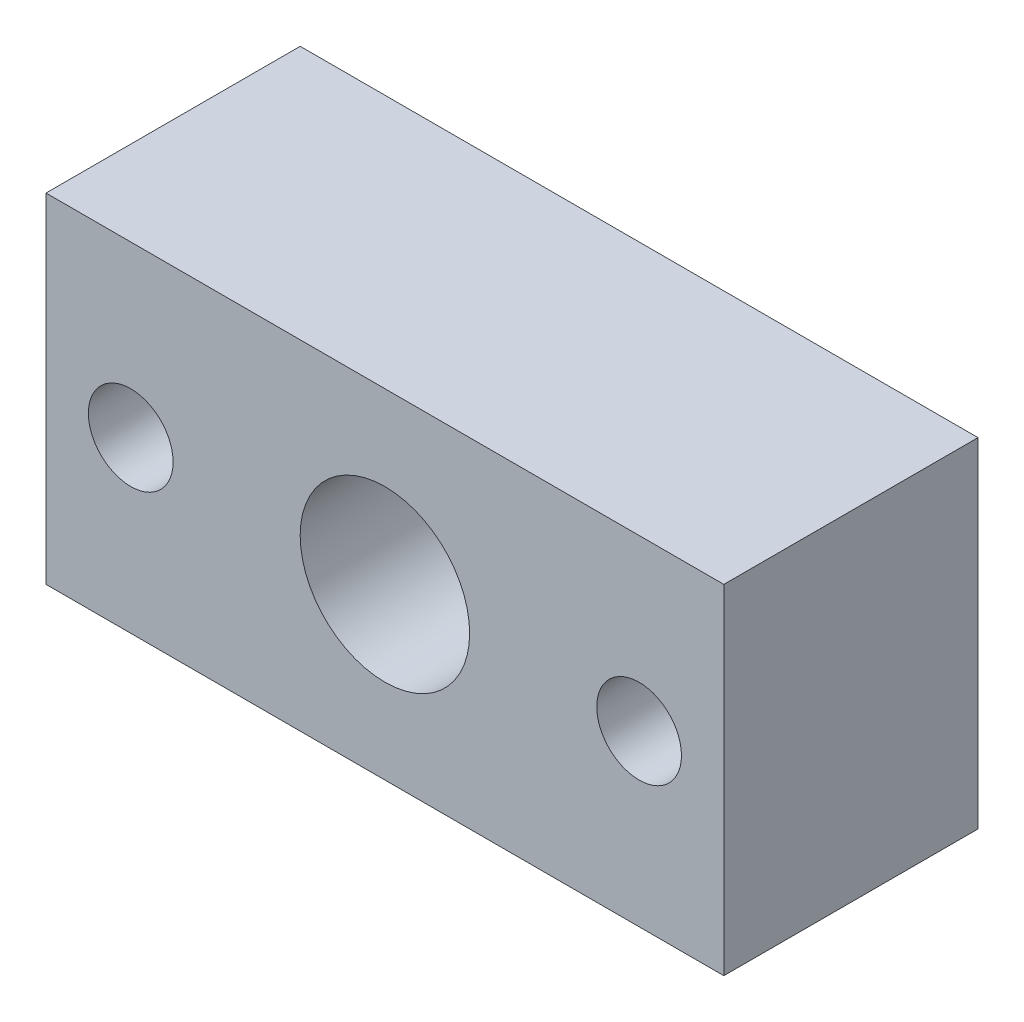
from build123d import *

# Parameters (mm, degrees)
SKETCH1_W           = 40
SKETCH1_H           = 20
SKETCH1_R           = 5
SKETCH1_R_2         = 2.5
BOSS_EXTRUDE1_DEPTH = 15


with BuildPart() as part:
    # Sketch1 → Boss-Extrude1 (new body)
    with BuildSketch(Plane.XY):
        with Locations((20, 10)):
            Rectangle(SKETCH1_W, SKETCH1_H)
        with Locations((20, 10)):
            Circle(SKETCH1_R, mode=Mode.SUBTRACT)
        with Locations((35, 10)):
            Circle(SKETCH1_R_2, mode=Mode.SUBTRACT)
        with Locations((5, 10)):
            Circle(SKETCH1_R_2, mode=Mode.SUBTRACT)
    extrude(amount=BOSS_EXTRUDE1_DEPTH)


solid = part.part
